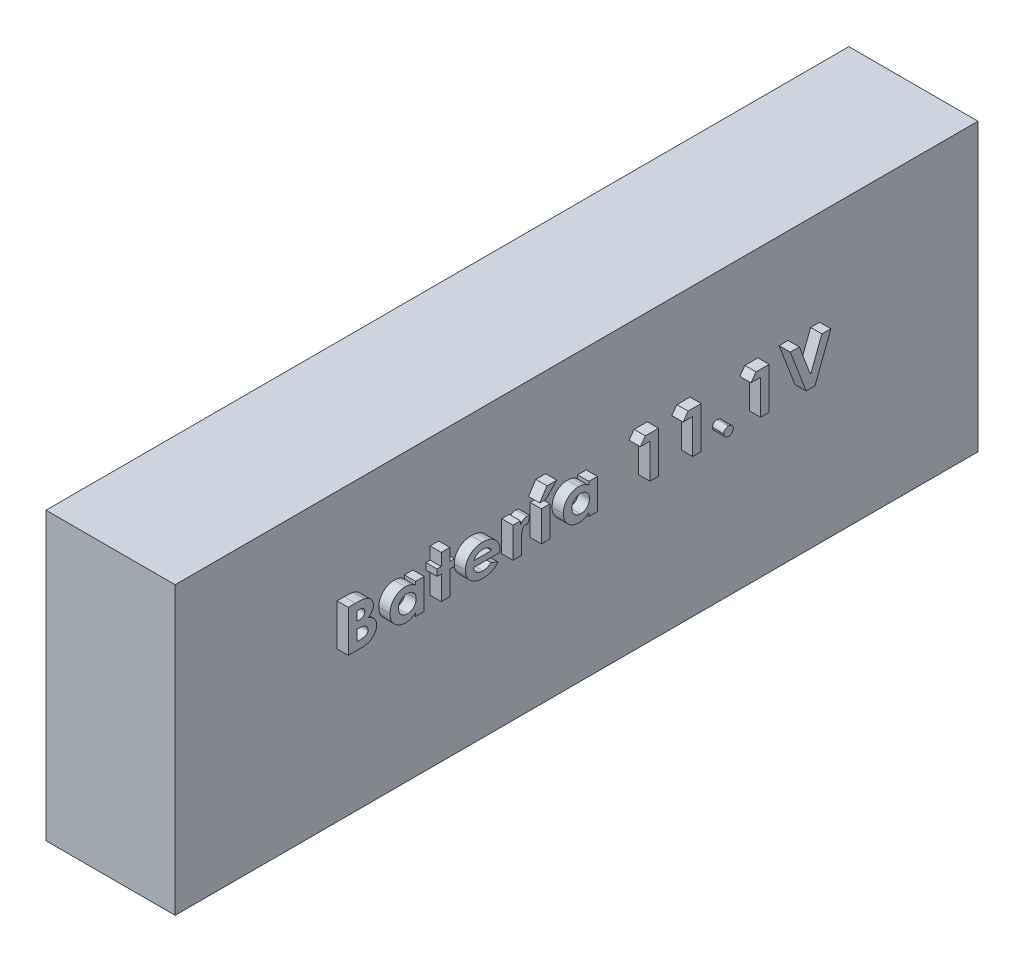
from build123d import *

# Parameters (mm, degrees)
CROQUIS1_W              = 23
CROQUIS1_H              = 51
SALIENTE_EXTRUIR1_DEPTH = 143
CROQUIS3_W              = 1.51965812
CROQUIS3_H              = 5.413782052
SALIENTE_EXTRUIR4_DEPTH = 2


with BuildPart() as part:
    # Croquis1 → Saliente-Extruir1 (new body)
    with BuildSketch(Plane.XY):
        with Locations((11.5, 25.5)):
            Rectangle(CROQUIS1_W, CROQUIS1_H)
    extrude(amount=SALIENTE_EXTRUIR1_DEPTH)

    # Croquis3 → Saliente-Extruir4 (add)
    # profile 1 of 13: a face of its own
    with BuildSketch(Plane(origin=(23, 0, 0), x_dir=(0, 0, -1), z_dir=(1, 0, 0))):
        with BuildLine():
            Line((-114.156239442, 26.685785391), (-114.156239442, 34.094118725))
            Line((-114.156239442, 34.094118725), (-112.887384274, 34.094118725))
            add(Edge.make_bspline(
                [(-112.887384274, 34.094118725), (-112.798334519, 34.094138301), (-112.626630634, 34.094176048), (-112.378779625, 34.085947089), (-112.149733893, 34.075560559), (-111.93875898, 34.063495415), (-111.746378561, 34.043510777), (-111.572048501, 34.021812624), (-111.41628961, 33.996168937), (-111.319633236, 33.972946953), (-111.274231563, 33.962039064)],
                knots=[0, 0, 0, 0, 1.317464385, 2.540307418, 3.668617805, 4.710020188, 5.666253162, 6.529600743, 7.309320385, 8, 8, 8, 8], degree=3))
            add(Edge.make_bspline(
                [(-111.274231563, 33.962039064), (-111.215106908, 33.946581239), (-111.098590834, 33.916118734), (-110.931179427, 33.856301263), (-110.772782164, 33.787397499), (-110.622673122, 33.711059059), (-110.482451985, 33.623346572), (-110.353139194, 33.524041108), (-110.230998165, 33.418070988), (-110.120109335, 33.301687029), (-110.01863129, 33.179844754), (-109.933031875, 33.049450707), (-109.857826853, 32.915629534), (-109.796270466, 32.77570543), (-109.751341333, 32.629431705), (-109.715890044, 32.478935498), (-109.697214688, 32.322145043), (-109.693917648, 32.215859257), (-109.692243716, 32.16189717)],
                knots=[0, 0, 0, 0, 1.129908737, 2.22669428, 3.283953805, 4.323365142, 5.338820687, 6.337986667, 7.3364402, 8.326515777, 9.308269818, 10.264974983, 11.206997704, 12.145325068, 13.085791276, 14.033572947, 15.001630318, 16, 16, 16, 16], degree=3))
            add(Edge.make_bspline(
                [(-109.692243716, 32.16189717), (-109.694184855, 32.092443178), (-109.69801551, 31.955382285), (-109.738641018, 31.755513025), (-109.800966733, 31.564766672), (-109.889304232, 31.382809333), (-110.008039949, 31.209671053), (-110.156449219, 31.042645476), (-110.337687524, 30.882066755), (-110.474335915, 30.784900161), (-110.545567367, 30.734249601)],
                knots=[0, 0, 0, 0, 0.956911373, 1.888374187, 2.80117783, 3.71980407, 4.668038401, 5.688098977, 6.794862754, 8, 8, 8, 8], degree=3))
            add(Edge.make_bspline(
                [(-110.545567367, 30.734249601), (-110.485913342, 30.707653948), (-110.369261117, 30.655646692), (-110.2030429, 30.569051486), (-110.04797805, 30.479431007), (-109.906893324, 30.382187386), (-109.777386308, 30.281822242), (-109.660577081, 30.17581594), (-109.556696664, 30.064339889), (-109.46417016, 29.948373612), (-109.383382274, 29.827147681), (-109.313503615, 29.700538614), (-109.253780387, 29.568724015), (-109.206785321, 29.430706345), (-109.167534572, 29.28874919), (-109.140824455, 29.140752001), (-109.126443752, 28.987326185), (-109.12374454, 28.88318389), (-109.122371921, 28.830224828)],
                knots=[0, 0, 0, 0, 1.23365294, 2.412383099, 3.539175734, 4.614933633, 5.646891323, 6.632618236, 7.591395346, 8.522583599, 9.432375455, 10.340100964, 11.252002374, 12.162322077, 13.091820502, 14.032202097, 14.999323654, 16, 16, 16, 16], degree=3))
            add(Edge.make_bspline(
                [(-109.122371921, 28.830224828), (-109.123586834, 28.779225145), (-109.125999211, 28.677958234), (-109.143073702, 28.527745986), (-109.168836881, 28.380577825), (-109.208824204, 28.237182971), (-109.256304919, 28.096480559), (-109.319037029, 27.960479884), (-109.389461206, 27.827096404), (-109.498231267, 27.655678322), (-109.654540225, 27.458344665), (-109.868329407, 27.248615472), (-110.110156286, 27.074154061), (-110.331195345, 26.955098621), (-110.522846691, 26.874912634), (-110.682027833, 26.826535741), (-110.852678509, 26.780157175), (-111.03774676, 26.748223417), (-111.234982156, 26.718795067), (-111.445623194, 26.700750728), (-111.669332786, 26.688385702), (-111.822813045, 26.686670252), (-111.901980962, 26.685785391)],
                knots=[0, 0, 0, 0, 0.773521683, 1.535934081, 2.291035939, 3.037398896, 3.792090463, 4.541089556, 5.30652434, 6.078916767, 7.617748108, 9.114279455, 10.607797396, 12.125440584, 12.912816195, 13.755334699, 14.647206127, 15.593606405, 16.601806249, 17.671867784, 18.799106946, 20, 20, 20, 20], degree=3))
            Line((-111.901980962, 26.685785391), (-114.156239442, 26.685785391))
        make_face()
        with BuildLine():
            Line((-112.636581323, 32.76441787), (-112.636581323, 31.149781118))
            Line((-112.636581323, 31.149781118), (-112.304156109, 31.149781118))
            add(Edge.make_bspline(
                [(-112.304156109, 31.149781118), (-112.259614146, 31.150216298), (-112.172872781, 31.151063773), (-112.04742586, 31.161436028), (-111.930789271, 31.178904869), (-111.82375996, 31.204355221), (-111.724759517, 31.235374705), (-111.634259179, 31.273203845), (-111.553546314, 31.319853356), (-111.458885349, 31.388609182), (-111.358667652, 31.490253447), (-111.272010594, 31.636867474), (-111.219968694, 31.804277258), (-111.214652838, 31.922586261), (-111.211901835, 31.983812234)],
                knots=[0, 0, 0, 0, 1.028550141, 2.003006515, 2.904681567, 3.749937983, 4.541273415, 5.29889787, 6.010313909, 6.689050998, 7.997958217, 9.273579902, 10.589053087, 12, 12, 12, 12], degree=3))
            add(Edge.make_bspline(
                [(-111.211901835, 31.983812234), (-111.21485438, 32.041061046), (-111.220539085, 32.151285475), (-111.269646959, 32.30761979), (-111.351750562, 32.444136607), (-111.466001784, 32.561165047), (-111.614143097, 32.6543518), (-111.795448747, 32.720378304), (-112.009802438, 32.757590929), (-112.163018697, 32.762042137), (-112.244794464, 32.76441787)],
                knots=[0, 0, 0, 0, 0.935650498, 1.801461716, 2.651522647, 3.522093803, 4.454478618, 5.492462911, 6.661657913, 8, 8, 8, 8], degree=3))
            Line((-112.244794464, 32.76441787), (-112.636581323, 32.76441787))
        make_face(mode=Mode.SUBTRACT)
        with BuildLine():
            Line((-112.636581323, 29.915058896), (-112.636581323, 28.015486246))
            Line((-112.636581323, 28.015486246), (-112.25369871, 28.015486246))
            add(Edge.make_bspline(
                [(-112.25369871, 28.015486246), (-112.17800233, 28.015918697), (-112.032466594, 28.016750137), (-111.82398691, 28.026795912), (-111.634426757, 28.044901652), (-111.464288399, 28.067505211), (-111.313311235, 28.098129497), (-111.182005606, 28.137064351), (-111.068570824, 28.179899473), (-110.97368705, 28.232805934), (-110.896172442, 28.294375935), (-110.826223636, 28.357301955), (-110.769191738, 28.429893065), (-110.724067036, 28.509033128), (-110.685011686, 28.592756249), (-110.661456257, 28.684331785), (-110.64352198, 28.781045657), (-110.642535009, 28.847940552), (-110.64203004, 28.882166267)],
                knots=[0, 0, 0, 0, 1.753078804, 3.370512758, 4.83203934, 6.162291463, 7.344201807, 8.395507345, 9.331626367, 10.147333109, 10.898971645, 11.62040215, 12.321813352, 13.025280112, 13.727906689, 14.453419512, 15.208716525, 16, 16, 16, 16], degree=3))
            add(Edge.make_bspline(
                [(-110.64203004, 28.882166267), (-110.64314364, 28.921303912), (-110.645312634, 28.997533514), (-110.663026826, 29.108951214), (-110.695219301, 29.212967029), (-110.735767294, 29.312240784), (-110.792191981, 29.403218134), (-110.859250793, 29.489047458), (-110.940274957, 29.566822312), (-111.031391356, 29.641246809), (-111.137669614, 29.706409488), (-111.259159594, 29.762949654), (-111.396521296, 29.810169919), (-111.550180213, 29.847766725), (-111.719462714, 29.879674614), (-111.905604378, 29.898727147), (-112.107054951, 29.912897352), (-112.246744056, 29.914322009), (-112.31899652, 29.915058896)],
                knots=[0, 0, 0, 0, 0.845221588, 1.646264278, 2.427170338, 3.19324141, 3.95557735, 4.731569926, 5.540061037, 6.376114724, 7.268642756, 8.224665384, 9.265483498, 10.400594375, 11.639216012, 12.983232105, 14.439614077, 16, 16, 16, 16], degree=3))
            Line((-112.31899652, 29.915058896), (-112.636581323, 29.915058896))
        make_face(mode=Mode.SUBTRACT)
    # profile 2 of 13: a face of its own
    with BuildSketch(Plane(origin=(23, 0, 0), x_dir=(0, 0, -1), z_dir=(1, 0, 0))):
        with BuildLine():
            Line((-102.169936023, 32.099567443), (-100.650277904, 32.099567443))
            Line((-100.650277904, 32.099567443), (-100.650277904, 26.685785391))
            Line((-100.650277904, 26.685785391), (-102.169936023, 26.685785391))
            Line((-102.169936023, 26.685785391), (-102.169936023, 27.276433762))
            add(Edge.make_bspline(
                [(-102.169936023, 27.276433762), (-102.240290145, 27.218887904), (-102.377152613, 27.106941824), (-102.592070902, 26.96225345), (-102.807524025, 26.842919916), (-103.02491578, 26.747547627), (-103.247240412, 26.678081273), (-103.475920677, 26.626753346), (-103.71403741, 26.59701444), (-103.876007749, 26.59289654), (-103.958205588, 26.590806759)],
                knots=[0, 0, 0, 0, 1.112775085, 2.164722404, 3.168089063, 4.125953898, 5.06678566, 6.016394462, 6.993346001, 8, 8, 8, 8], degree=3))
            add(Edge.make_bspline(
                [(-103.958205588, 26.590806759), (-104.050860826, 26.592739591), (-104.233546178, 26.596550495), (-104.501765956, 26.637202062), (-104.760827554, 26.699281954), (-105.010701518, 26.786819231), (-105.250355206, 26.900618099), (-105.48115901, 27.037812182), (-105.700446385, 27.202583429), (-105.909934967, 27.387703903), (-106.101655102, 27.59177145), (-106.268857242, 27.812070557), (-106.412868288, 28.043114693), (-106.526184522, 28.28877867), (-106.618843236, 28.543921435), (-106.681543538, 28.812951178), (-106.721210154, 29.09369529), (-106.726319756, 29.285195408), (-106.728910382, 29.382288129)],
                knots=[0, 0, 0, 0, 1.0152099, 2.001656708, 2.967260261, 3.933046601, 4.898711087, 5.871705171, 6.871894424, 7.901591717, 8.933871443, 9.936249634, 10.929769113, 11.912465925, 12.897211317, 13.900997302, 14.935781943, 16, 16, 16, 16], degree=3))
            add(Edge.make_bspline(
                [(-106.728910382, 29.382288129), (-106.727060892, 29.482862847), (-106.723429489, 29.680337441), (-106.682112175, 29.968982468), (-106.623637501, 30.245158078), (-106.53460466, 30.505692699), (-106.423127738, 30.753550684), (-106.284100845, 30.985749897), (-106.123581492, 31.206679018), (-105.936095633, 31.407816043), (-105.733675647, 31.591717651), (-105.518829129, 31.754039909), (-105.291606133, 31.889568547), (-105.054069985, 32.001239849), (-104.805732815, 32.087612844), (-104.547444589, 32.150313222), (-104.277912833, 32.18826206), (-104.094365466, 32.192430977), (-104.001242781, 32.194546075)],
                knots=[0, 0, 0, 0, 1.101820251, 2.163381712, 3.191069616, 4.192666871, 5.175648538, 6.165310336, 7.154600546, 8.164081233, 9.173911513, 10.150137213, 11.110950052, 12.069310662, 13.022979241, 13.98849509, 14.979463764, 16, 16, 16, 16], degree=3))
            add(Edge.make_bspline(
                [(-104.001242781, 32.194546075), (-103.915035551, 32.192903018), (-103.744885246, 32.189660056), (-103.494297647, 32.15323122), (-103.25147505, 32.099588317), (-103.017501967, 32.020945408), (-102.790348797, 31.923840908), (-102.573967111, 31.800371833), (-102.363628259, 31.658522989), (-102.235108345, 31.546455732), (-102.169936023, 31.489626537)],
                knots=[0, 0, 0, 0, 1.029049168, 2.031071275, 3.018790206, 3.996113396, 4.975346277, 5.964866617, 6.967985876, 8, 8, 8, 8], degree=3))
            Line((-102.169936023, 31.489626537), (-102.169936023, 32.099567443))
        make_face()
        with BuildLine():
            add(Edge.make_bspline(
                [(-103.655461197, 30.959823853), (-103.709925569, 30.958170815), (-103.817212479, 30.95491457), (-103.974883019, 30.935992848), (-104.12574873, 30.902089267), (-104.268288938, 30.852125578), (-104.404935731, 30.791911397), (-104.532930328, 30.714829888), (-104.655090707, 30.625936019), (-104.768555952, 30.52366595), (-104.872371565, 30.412078417), (-104.961876373, 30.290025158), (-105.039653316, 30.162111335), (-105.100329587, 30.024393878), (-105.150115732, 29.880750256), (-105.183607813, 29.727815426), (-105.20482495, 29.567895123), (-105.20776228, 29.458537269), (-105.209252263, 29.403064705)],
                knots=[0, 0, 0, 0, 1.06125293, 2.090514301, 3.088852962, 4.067220482, 5.02916782, 5.992803506, 6.972072552, 7.968548639, 8.964372002, 9.935879718, 10.912727001, 11.87467434, 12.862161171, 13.869899327, 14.919490992, 16, 16, 16, 16], degree=3))
            add(Edge.make_bspline(
                [(-105.209252263, 29.403064705), (-105.207712958, 29.347109816), (-105.204678104, 29.236790552), (-105.184145328, 29.07511592), (-105.148086377, 28.921208305), (-105.099051666, 28.775031911), (-105.036554711, 28.635979357), (-104.959399204, 28.504685737), (-104.865656464, 28.382695938), (-104.76182006, 28.267499319), (-104.646014398, 28.164098454), (-104.523063838, 28.073144991), (-104.392900443, 27.997205765), (-104.256862192, 27.934269523), (-104.114261997, 27.884991005), (-103.964884847, 27.851417661), (-103.809438042, 27.829848051), (-103.703518262, 27.826987277), (-103.649525032, 27.825528981)],
                knots=[0, 0, 0, 0, 1.082549706, 2.134328006, 3.146519463, 4.136198695, 5.112834422, 6.091110098, 7.074987703, 8.084460647, 9.087516082, 10.073346842, 11.03851981, 11.997742943, 12.969300807, 13.95136129, 14.955694387, 16, 16, 16, 16], degree=3))
            add(Edge.make_bspline(
                [(-103.649525032, 27.825528981), (-103.594073159, 27.827171356), (-103.485308479, 27.830392752), (-103.325638353, 27.84929791), (-103.172959377, 27.883600465), (-103.028079493, 27.932689297), (-102.889972159, 27.994254894), (-102.758636963, 28.067769109), (-102.636621549, 28.15865481), (-102.521031707, 28.260070999), (-102.41650458, 28.373433588), (-102.324980404, 28.496301648), (-102.247472723, 28.627683658), (-102.18351774, 28.767326024), (-102.134033903, 28.915556619), (-102.100602241, 29.072402552), (-102.079323769, 29.237260197), (-102.076430735, 29.350067235), (-102.074957391, 29.407516828)],
                knots=[0, 0, 0, 0, 1.062730516, 2.084465995, 3.075623017, 4.055840787, 5.010610896, 5.970028257, 6.933184594, 7.920344632, 8.913177399, 9.881961517, 10.850884751, 11.830735776, 12.819941745, 13.838859124, 14.899389017, 16, 16, 16, 16], degree=3))
            add(Edge.make_bspline(
                [(-102.074957391, 29.407516828), (-102.076408242, 29.463979469), (-102.079243752, 29.574328783), (-102.100683224, 29.735732653), (-102.134362159, 29.889506822), (-102.18284325, 30.035180762), (-102.247884616, 30.171435759), (-102.325460323, 30.299652903), (-102.416003603, 30.420874191), (-102.521686757, 30.531132948), (-102.636615169, 30.63192576), (-102.760207943, 30.719472722), (-102.890509994, 30.794799311), (-103.028705132, 30.855984839), (-103.17546203, 30.901153555), (-103.328553077, 30.936267352), (-103.489782639, 30.954901499), (-103.599521033, 30.958161856), (-103.655461197, 30.959823853)],
                knots=[0, 0, 0, 0, 1.089815487, 2.129910827, 3.137850205, 4.125449086, 5.086697262, 6.046521014, 7.014954071, 8.001305313, 8.989596646, 9.962165112, 10.920514735, 11.891205654, 12.872875738, 13.880815117, 14.919725862, 16, 16, 16, 16], degree=3))
        make_face(mode=Mode.SUBTRACT)
    # profile 3 of 13: a face of its own
    with BuildSketch(Plane(origin=(23, 0, 0), x_dir=(0, 0, -1), z_dir=(1, 0, 0))):
        Polygon((-97.591965938, 34.28407599), (-96.072307818, 34.28407599), (-96.072307818, 32.099567443), (-95.217500126, 32.099567443), (-95.217500126, 30.959823853), (-96.072307818, 30.959823853), (-96.072307818, 26.685785391), (-97.591965938, 26.685785391), (-97.591965938, 30.959823853), (-98.351794998, 30.959823853), (-98.351794998, 32.099567443), (-97.591965938, 32.099567443), align=None)
    # profile 4 of 13: a face of its own
    with BuildSketch(Plane(origin=(23, 0, 0), x_dir=(0, 0, -1), z_dir=(1, 0, 0))):
        with BuildLine():
            Line((-87.131256803, 29.060251203), (-91.874252263, 29.060251203))
            add(Edge.make_bspline(
                [(-91.874252263, 29.060251203), (-91.864653173, 29.010605675), (-91.845750047, 28.912840608), (-91.804136402, 28.771039552), (-91.750309241, 28.637953355), (-91.688040008, 28.511639818), (-91.613440219, 28.393720623), (-91.526685962, 28.284533193), (-91.431945218, 28.18062284), (-91.324424375, 28.087971352), (-91.209362586, 28.003159593), (-91.085217632, 27.929723792), (-90.952498194, 27.869304693), (-90.812933036, 27.819077268), (-90.666305475, 27.778195038), (-90.51130562, 27.750396048), (-90.348508742, 27.73424913), (-90.23739116, 27.731796095), (-90.180961331, 27.730550349)],
                knots=[0, 0, 0, 0, 1.02675315, 2.021946266, 2.995963183, 3.939653043, 4.879107122, 5.823866319, 6.769533503, 7.73087287, 8.701618913, 9.670126111, 10.654762421, 11.659195967, 12.680625029, 13.742950566, 14.85378253, 16, 16, 16, 16], degree=3))
            add(Edge.make_bspline(
                [(-90.180961331, 27.730550349), (-90.112590855, 27.732130086), (-89.978279594, 27.735233422), (-89.780802802, 27.76368523), (-89.589898324, 27.805327927), (-89.407391069, 27.868581059), (-89.231843891, 27.947778655), (-89.063897745, 28.044714133), (-88.902363451, 28.158999786), (-88.803424794, 28.247949941), (-88.753313761, 28.293001938)],
                knots=[0, 0, 0, 0, 1.042357442, 2.04767252, 3.038064469, 4.018865418, 4.988131768, 5.971860357, 6.97277591, 8, 8, 8, 8], degree=3))
            Line((-88.753313761, 28.293001938), (-87.505235169, 27.763199253))
            add(Edge.make_bspline(
                [(-87.505235169, 27.763199253), (-87.544157397, 27.714652135), (-87.621627052, 27.618025382), (-87.748511502, 27.484123338), (-87.878624314, 27.357080089), (-88.015509835, 27.241070337), (-88.158710029, 27.135641013), (-88.306891064, 27.038640881), (-88.462059577, 26.95280812), (-88.622230339, 26.875117624), (-88.789532703, 26.80825989), (-88.964166736, 26.75057623), (-89.14566833, 26.699805465), (-89.335622169, 26.659970214), (-89.532297585, 26.629082787), (-89.736820018, 26.606845305), (-89.948770454, 26.593276661), (-90.092887882, 26.591638956), (-90.166120919, 26.590806759)],
                knots=[0, 0, 0, 0, 0.988037034, 1.966559754, 2.927989197, 3.875802216, 4.814087919, 5.751320033, 6.687068532, 7.628999734, 8.57749659, 9.546634608, 10.549435947, 11.56972693, 12.627810391, 13.710812346, 14.836752995, 16, 16, 16, 16], degree=3))
            add(Edge.make_bspline(
                [(-90.166120919, 26.590806759), (-90.279008336, 26.592908814), (-90.50047258, 26.597032657), (-90.824263969, 26.634579106), (-91.131930463, 26.697230811), (-91.423955979, 26.782717526), (-91.700080566, 26.894238638), (-91.959350158, 27.03215858), (-92.204258257, 27.191900001), (-92.428180335, 27.378032974), (-92.632905913, 27.579346571), (-92.810770539, 27.797535301), (-92.960742655, 28.028256443), (-93.085908509, 28.270237625), (-93.180948185, 28.526094393), (-93.248750655, 28.794269078), (-93.291995406, 29.074681068), (-93.296595291, 29.265878889), (-93.29893175, 29.362995594)],
                knots=[0, 0, 0, 0, 1.156492121, 2.268823763, 3.334565049, 4.370720398, 5.382660527, 6.380407603, 7.375834034, 8.373439447, 9.359176821, 10.313980535, 11.25179889, 12.17452123, 13.100079815, 14.041862899, 15.005387074, 16, 16, 16, 16], degree=3))
            add(Edge.make_bspline(
                [(-93.29893175, 29.362995594), (-93.296622678, 29.462590626), (-93.292075467, 29.658721143), (-93.248574328, 29.945315286), (-93.18283463, 30.219868891), (-93.086465033, 30.480622061), (-92.965495778, 30.72998517), (-92.813035712, 30.963605613), (-92.637667147, 31.186594185), (-92.434852196, 31.392633563), (-92.211758042, 31.57973049), (-91.974006673, 31.746308787), (-91.720469502, 31.883983881), (-91.454087073, 31.997496059), (-91.174188017, 32.087657012), (-90.879488866, 32.147984076), (-90.57192304, 32.189019917), (-90.362154689, 32.192679515), (-90.255163387, 32.194546075)],
                knots=[0, 0, 0, 0, 1.027660379, 2.023751168, 2.986290373, 3.938022534, 4.888273355, 5.841771876, 6.812555766, 7.813036829, 8.820805457, 9.815428515, 10.805160989, 11.793719818, 12.801669636, 13.835480315, 14.895997518, 16, 16, 16, 16], degree=3))
            add(Edge.make_bspline(
                [(-90.255163387, 32.194546075), (-90.14177819, 32.192490954), (-89.920304628, 32.188476718), (-89.596055995, 32.150518732), (-89.288421548, 32.088121069), (-88.99573482, 32.003535034), (-88.721780983, 31.888357887), (-88.461123963, 31.754389107), (-88.218996341, 31.590987627), (-87.993546775, 31.40599665), (-87.78945162, 31.201189154), (-87.61131054, 30.97825527), (-87.460090746, 30.739766072), (-87.338491951, 30.484246041), (-87.24269845, 30.213705184), (-87.175120341, 29.927127964), (-87.132117555, 29.624500746), (-87.127619431, 29.417065264), (-87.125320639, 29.311054155)],
                knots=[0, 0, 0, 0, 1.136656473, 2.220213596, 3.267968283, 4.28191029, 5.269443916, 6.243492268, 7.216188134, 8.192406648, 9.164026768, 10.109943221, 11.048534419, 11.989272945, 12.941606068, 13.920982876, 14.937506202, 16, 16, 16, 16], degree=3))
            Line((-87.125320639, 29.311054155), (-87.131256803, 29.060251203))
        make_face()
        with BuildLine():
            add(Edge.make_bspline(
                [(-88.644978758, 30.10501616), (-88.672299057, 30.172968977), (-88.727060187, 30.309174406), (-88.852994828, 30.493949285), (-89.016055564, 30.656058148), (-89.209311403, 30.796956518), (-89.428183098, 30.912272736), (-89.666532078, 30.996000563), (-89.922136594, 31.046028803), (-90.098121934, 31.051828122), (-90.188381536, 31.054802485)],
                knots=[0, 0, 0, 0, 0.907776179, 1.819557287, 2.753735674, 3.75169848, 4.779685399, 5.815520848, 6.87962135, 8, 8, 8, 8], degree=3))
            add(Edge.make_bspline(
                [(-90.188381536, 31.054802485), (-90.286172844, 31.051895586), (-90.477542476, 31.046207019), (-90.754216972, 30.986450301), (-91.015597039, 30.897402303), (-91.171679253, 30.804364492), (-91.249470946, 30.757994259)],
                knots=[0, 0, 0, 0, 1.04897034, 2.052749604, 3.029486454, 4, 4, 4, 4], degree=3))
            add(Edge.make_bspline(
                [(-91.249470946, 30.757994259), (-91.297798408, 30.722913097), (-91.399796847, 30.648871889), (-91.53361868, 30.498779437), (-91.663420521, 30.316334809), (-91.739180427, 30.178147055), (-91.77927363, 30.10501616)],
                knots=[0, 0, 0, 0, 0.841454166, 1.775946969, 2.822999996, 4, 4, 4, 4], degree=3))
            Line((-91.77927363, 30.10501616), (-88.644978758, 30.10501616))
        make_face(mode=Mode.SUBTRACT)
    # profile 5 of 13: a face of its own
    with BuildSketch(Plane(origin=(23, 0, 0), x_dir=(0, 0, -1), z_dir=(1, 0, 0))):
        with BuildLine():
            Line((-84.826837733, 32.099567443), (-83.497136878, 32.099567443))
            Line((-83.497136878, 32.099567443), (-83.497136878, 31.433232974))
            add(Edge.make_bspline(
                [(-83.497136878, 31.433232974), (-83.46489572, 31.492450302), (-83.401879039, 31.608193025), (-83.28611211, 31.76355471), (-83.153114374, 31.894395987), (-83.00766485, 32.00345352), (-82.849322709, 32.088453158), (-82.682328072, 32.149026115), (-82.508109574, 32.188390145), (-82.389263621, 32.192479323), (-82.329196507, 32.194546075)],
                knots=[0, 0, 0, 0, 1.09866127, 2.147379032, 3.14564304, 4.131443017, 5.102343063, 6.064490016, 7.021754664, 8, 8, 8, 8], degree=3))
            add(Edge.make_bspline(
                [(-82.329196507, 32.194546075), (-82.285580287, 32.192503692), (-82.196762088, 32.188344671), (-82.061390655, 32.164168218), (-81.924066051, 32.120452595), (-81.833694627, 32.081092486), (-81.787521493, 32.060982373)],
                knots=[0, 0, 0, 0, 0.931404136, 1.896671404, 2.925354185, 4, 4, 4, 4], degree=3))
            Line((-81.787521493, 32.060982373), (-82.200084928, 30.934595154))
            add(Edge.make_bspline(
                [(-82.200084928, 30.934595154), (-82.236962208, 30.952412472), (-82.306277298, 30.985902172), (-82.406910773, 31.025423468), (-82.498239824, 31.049537432), (-82.556140766, 31.053135446), (-82.58296754, 31.054802485)],
                knots=[0, 0, 0, 0, 1.214386998, 2.282580073, 3.20428172, 4, 4, 4, 4], degree=3))
            add(Edge.make_bspline(
                [(-82.58296754, 31.054802485), (-82.608297233, 31.053697817), (-82.658125103, 31.051524745), (-82.731669644, 31.032902251), (-82.800933287, 31.000788338), (-82.869253843, 30.959647228), (-82.931241577, 30.902458009), (-82.993191024, 30.836251333), (-83.047784193, 30.754510385), (-83.105395819, 30.663528559), (-83.154450058, 30.552166886), (-83.196512558, 30.419223998), (-83.233990583, 30.263161653), (-83.259780581, 30.083151237), (-83.28470765, 29.880934662), (-83.299544853, 29.655027683), (-83.310603209, 29.406144639), (-83.311279353, 29.232415293), (-83.311631737, 29.141873466)],
                knots=[0, 0, 0, 0, 0.544232178, 1.070598461, 1.618251235, 2.182094276, 2.777567932, 3.425210017, 4.127676488, 4.886675562, 5.738955394, 6.734782583, 7.883056018, 9.186093582, 10.642914445, 12.264202625, 14.053029461, 16, 16, 16, 16], degree=3))
            Line((-83.311631737, 29.141873466), (-83.307179613, 28.877714144))
            Line((-83.307179613, 28.877714144), (-83.307179613, 26.685785391))
            Line((-83.307179613, 26.685785391), (-84.826837733, 26.685785391))
            Line((-84.826837733, 26.685785391), (-84.826837733, 32.099567443))
        make_face()
    # profile 6 of 13: a face of its own
    with BuildSketch(Plane(origin=(23, 0, 0), x_dir=(0, 0, -1), z_dir=(1, 0, 0))):
        with Locations((-79.014145425, 29.392676417)):
            Rectangle(CROQUIS3_W, CROQUIS3_H)
    # profile 7 of 13: a face of its own
    with BuildSketch(Plane(origin=(23, 0, 0), x_dir=(0, 0, -1), z_dir=(1, 0, 0))):
        Polygon((-78.766310556, 35.138883682), (-77.019594143, 35.138883682), (-78.999305014, 33.1443324), (-80.058910382, 33.1443324), align=None)
    # profile 8 of 13: a face of its own
    with BuildSketch(Plane(origin=(23, 0, 0), x_dir=(0, 0, -1), z_dir=(1, 0, 0))):
        with BuildLine():
            Line((-71.301880468, 32.099567443), (-69.782222348, 32.099567443))
            Line((-69.782222348, 32.099567443), (-69.782222348, 26.685785391))
            Line((-69.782222348, 26.685785391), (-71.301880468, 26.685785391))
            Line((-71.301880468, 26.685785391), (-71.301880468, 27.276433762))
            add(Edge.make_bspline(
                [(-71.301880468, 27.276433762), (-71.37223459, 27.218887904), (-71.509097057, 27.106941824), (-71.724015346, 26.96225345), (-71.939468469, 26.842919916), (-72.156860224, 26.747547627), (-72.379184857, 26.678081273), (-72.607865122, 26.626753346), (-72.845981854, 26.59701444), (-73.007952193, 26.59289654), (-73.090150032, 26.590806759)],
                knots=[0, 0, 0, 0, 1.112775085, 2.164722404, 3.168089063, 4.125953898, 5.06678566, 6.016394462, 6.993346001, 8, 8, 8, 8], degree=3))
            add(Edge.make_bspline(
                [(-73.090150032, 26.590806759), (-73.18280527, 26.592739591), (-73.365490623, 26.596550495), (-73.633710401, 26.637202062), (-73.892771998, 26.699281954), (-74.142645963, 26.786819231), (-74.382299651, 26.900618099), (-74.613103455, 27.037812182), (-74.832390829, 27.202583429), (-75.041879411, 27.387703903), (-75.233599546, 27.59177145), (-75.400801686, 27.812070557), (-75.544812732, 28.043114693), (-75.658128967, 28.28877867), (-75.75078768, 28.543921435), (-75.813487983, 28.812951178), (-75.853154598, 29.09369529), (-75.858264201, 29.285195408), (-75.860854827, 29.382288129)],
                knots=[0, 0, 0, 0, 1.0152099, 2.001656708, 2.967260261, 3.933046601, 4.898711087, 5.871705171, 6.871894424, 7.901591717, 8.933871443, 9.936249634, 10.929769113, 11.912465925, 12.897211317, 13.900997302, 14.935781943, 16, 16, 16, 16], degree=3))
            add(Edge.make_bspline(
                [(-75.860854827, 29.382288129), (-75.859005336, 29.482862847), (-75.855373933, 29.680337441), (-75.81405662, 29.968982468), (-75.755581945, 30.245158078), (-75.666549105, 30.505692699), (-75.555072182, 30.753550684), (-75.41604529, 30.985749897), (-75.255525937, 31.206679018), (-75.068040077, 31.407816043), (-74.865620091, 31.591717651), (-74.650773573, 31.754039909), (-74.423550577, 31.889568547), (-74.18601443, 32.001239849), (-73.937677259, 32.087612844), (-73.679389033, 32.150313222), (-73.409857278, 32.18826206), (-73.226309911, 32.192430977), (-73.133187225, 32.194546075)],
                knots=[0, 0, 0, 0, 1.101820251, 2.163381712, 3.191069616, 4.192666871, 5.175648538, 6.165310336, 7.154600546, 8.164081233, 9.173911513, 10.150137213, 11.110950052, 12.069310662, 13.022979241, 13.98849509, 14.979463764, 16, 16, 16, 16], degree=3))
            add(Edge.make_bspline(
                [(-73.133187225, 32.194546075), (-73.046979995, 32.192903018), (-72.876829691, 32.189660056), (-72.626242092, 32.15323122), (-72.383419495, 32.099588317), (-72.149446411, 32.020945408), (-71.922293241, 31.923840908), (-71.705911556, 31.800371833), (-71.495572704, 31.658522989), (-71.367052789, 31.546455732), (-71.301880468, 31.489626537)],
                knots=[0, 0, 0, 0, 1.029049168, 2.031071275, 3.018790206, 3.996113396, 4.975346277, 5.964866617, 6.967985876, 8, 8, 8, 8], degree=3))
            Line((-71.301880468, 31.489626537), (-71.301880468, 32.099567443))
        make_face()
        with BuildLine():
            add(Edge.make_bspline(
                [(-72.787405641, 30.959823853), (-72.841870013, 30.958170815), (-72.949156924, 30.95491457), (-73.106827463, 30.935992848), (-73.257693174, 30.902089267), (-73.400233382, 30.852125578), (-73.536880176, 30.791911397), (-73.664874772, 30.714829888), (-73.787035152, 30.625936019), (-73.900500397, 30.52366595), (-74.00431601, 30.412078417), (-74.093820817, 30.290025158), (-74.171597761, 30.162111335), (-74.232274031, 30.024393878), (-74.282060176, 29.880750256), (-74.315552257, 29.727815426), (-74.336769394, 29.567895123), (-74.339706725, 29.458537269), (-74.341196707, 29.403064705)],
                knots=[0, 0, 0, 0, 1.06125293, 2.090514301, 3.088852962, 4.067220482, 5.02916782, 5.992803506, 6.972072552, 7.968548639, 8.964372002, 9.935879718, 10.912727001, 11.87467434, 12.862161171, 13.869899327, 14.919490992, 16, 16, 16, 16], degree=3))
            add(Edge.make_bspline(
                [(-74.341196707, 29.403064705), (-74.339657403, 29.347109816), (-74.336622549, 29.236790552), (-74.316089772, 29.07511592), (-74.280030822, 28.921208305), (-74.23099611, 28.775031911), (-74.168499155, 28.635979357), (-74.091343648, 28.504685737), (-73.997600909, 28.382695938), (-73.893764505, 28.267499319), (-73.777958842, 28.164098454), (-73.655008283, 28.073144991), (-73.524844887, 27.997205765), (-73.388806637, 27.934269523), (-73.246206442, 27.884991005), (-73.096829291, 27.851417661), (-72.941382487, 27.829848051), (-72.835462707, 27.826987277), (-72.781469477, 27.825528981)],
                knots=[0, 0, 0, 0, 1.082549706, 2.134328006, 3.146519463, 4.136198695, 5.112834422, 6.091110098, 7.074987703, 8.084460647, 9.087516082, 10.073346842, 11.03851981, 11.997742943, 12.969300807, 13.95136129, 14.955694387, 16, 16, 16, 16], degree=3))
            add(Edge.make_bspline(
                [(-72.781469477, 27.825528981), (-72.726017604, 27.827171356), (-72.617252924, 27.830392752), (-72.457582797, 27.84929791), (-72.304903822, 27.883600465), (-72.160023938, 27.932689297), (-72.021916603, 27.994254894), (-71.890581407, 28.067769109), (-71.768565994, 28.15865481), (-71.652976151, 28.260070999), (-71.548449025, 28.373433588), (-71.456924848, 28.496301648), (-71.379417167, 28.627683658), (-71.315462185, 28.767326024), (-71.265978348, 28.915556619), (-71.232546686, 29.072402552), (-71.211268214, 29.237260197), (-71.20837518, 29.350067235), (-71.206901835, 29.407516828)],
                knots=[0, 0, 0, 0, 1.062730516, 2.084465995, 3.075623017, 4.055840787, 5.010610896, 5.970028257, 6.933184594, 7.920344632, 8.913177399, 9.881961517, 10.850884751, 11.830735776, 12.819941745, 13.838859124, 14.899389017, 16, 16, 16, 16], degree=3))
            add(Edge.make_bspline(
                [(-71.206901835, 29.407516828), (-71.208352686, 29.463979469), (-71.211188197, 29.574328783), (-71.232627668, 29.735732653), (-71.266306603, 29.889506822), (-71.314787694, 30.035180762), (-71.37982906, 30.171435759), (-71.457404767, 30.299652903), (-71.547948047, 30.420874191), (-71.653631201, 30.531132948), (-71.768559614, 30.63192576), (-71.892152388, 30.719472722), (-72.022454438, 30.794799311), (-72.160649576, 30.855984839), (-72.307406474, 30.901153555), (-72.460497521, 30.936267352), (-72.621727084, 30.954901499), (-72.731465478, 30.958161856), (-72.787405641, 30.959823853)],
                knots=[0, 0, 0, 0, 1.089815487, 2.129910827, 3.137850205, 4.125449086, 5.086697262, 6.046521014, 7.014954071, 8.001305313, 8.989596646, 9.962165112, 10.920514735, 11.891205654, 12.872875738, 13.880815117, 14.919725862, 16, 16, 16, 16], degree=3))
        make_face(mode=Mode.SUBTRACT)
    # profile 9 of 13: a face of its own
    with BuildSketch(Plane(origin=(23, 0, 0), x_dir=(0, 0, -1), z_dir=(1, 0, 0))):
        Polygon((-61.245127329, 34.094118725), (-58.916666793, 34.094118725), (-58.916666793, 26.685785391), (-60.436324912, 26.685785391), (-60.436324912, 32.859396502), (-62.145940297, 32.859396502), align=None)
    # profile 10 of 13: a face of its own
    with BuildSketch(Plane(origin=(23, 0, 0), x_dir=(0, 0, -1), z_dir=(1, 0, 0))):
        Polygon((-53.627841005, 34.094118725), (-51.299380468, 34.094118725), (-51.299380468, 26.685785391), (-52.819038587, 26.685785391), (-52.819038587, 32.859396502), (-54.528653972, 32.859396502), align=None)
    # profile 11 of 13: a face of its own
    with BuildSketch(Plane(origin=(23, 0, 0), x_dir=(0, 0, -1), z_dir=(1, 0, 0))):
        with BuildLine():
            add(Edge.make_bspline(
                [(-46.436474485, 28.205443511), (-46.379326192, 28.202594067), (-46.267771599, 28.197031897), (-46.106602794, 28.153189368), (-45.960434825, 28.076499099), (-45.829675292, 27.975073892), (-45.719589208, 27.853132752), (-45.638967598, 27.714376769), (-45.591119562, 27.561455773), (-45.584864997, 27.455349515), (-45.581666793, 27.401093217)],
                knots=[0, 0, 0, 0, 1.050960634, 2.051495835, 3.045047574, 4.070337556, 5.082732343, 6.049389773, 7.002576374, 8, 8, 8, 8], degree=3))
            add(Edge.make_bspline(
                [(-45.581666793, 27.401093217), (-45.58484722, 27.34682751), (-45.59106702, 27.240702851), (-45.639298358, 27.087502064), (-45.719468237, 26.947587253), (-45.829671731, 26.824336806), (-45.959931819, 26.720978144), (-46.106910497, 26.645047295), (-46.267489285, 26.59872083), (-46.379275561, 26.593485552), (-46.436474485, 26.590806759)],
                knots=[0, 0, 0, 0, 0.994594283, 1.945077027, 2.916869557, 3.933186909, 4.961156098, 5.951889477, 6.952020575, 8, 8, 8, 8], degree=3))
            add(Edge.make_bspline(
                [(-46.436474485, 26.590806759), (-46.493673408, 26.593485552), (-46.605459684, 26.59872083), (-46.766038473, 26.645047295), (-46.913017151, 26.720978144), (-47.043277239, 26.824336806), (-47.153480733, 26.947587253), (-47.233650612, 27.087502064), (-47.28188195, 27.240702851), (-47.288101749, 27.34682751), (-47.291282177, 27.401093217)],
                knots=[0, 0, 0, 0, 1.047979425, 2.048110523, 3.038843902, 4.066813091, 5.083130443, 6.054922973, 7.005405717, 8, 8, 8, 8], degree=3))
            add(Edge.make_bspline(
                [(-47.291282177, 27.401093217), (-47.288083973, 27.455349515), (-47.281829408, 27.561455773), (-47.233981372, 27.714376769), (-47.153359762, 27.853132752), (-47.043273678, 27.975073892), (-46.912514145, 28.076499099), (-46.766346176, 28.153189368), (-46.605177371, 28.197031897), (-46.493622778, 28.202594067), (-46.436474485, 28.205443511)],
                knots=[0, 0, 0, 0, 0.997423626, 1.950610227, 2.917267657, 3.929662444, 4.954952426, 5.948504165, 6.949039366, 8, 8, 8, 8], degree=3))
        make_face()
    # profile 12 of 13: a face of its own
    with BuildSketch(Plane(origin=(23, 0, 0), x_dir=(0, 0, -1), z_dir=(1, 0, 0))):
        Polygon((-41.527563227, 34.094118725), (-39.19910269, 34.094118725), (-39.19910269, 26.685785391), (-40.71876081, 26.685785391), (-40.71876081, 32.859396502), (-42.428376194, 32.859396502), align=None)
    # profile 13 of 13: a face of its own
    with BuildSketch(Plane(origin=(23, 0, 0), x_dir=(0, 0, -1), z_dir=(1, 0, 0))):
        Polygon((-35.428450981, 34.094118725), (-33.827170599, 34.094118725), (-31.819262946, 28.831708869), (-29.812839335, 34.094118725), (-28.210074912, 34.094118725), (-31.03717327, 26.685785391), (-32.604320706, 26.685785391), align=None)
    extrude(amount=SALIENTE_EXTRUIR4_DEPTH)


solid = part.part
